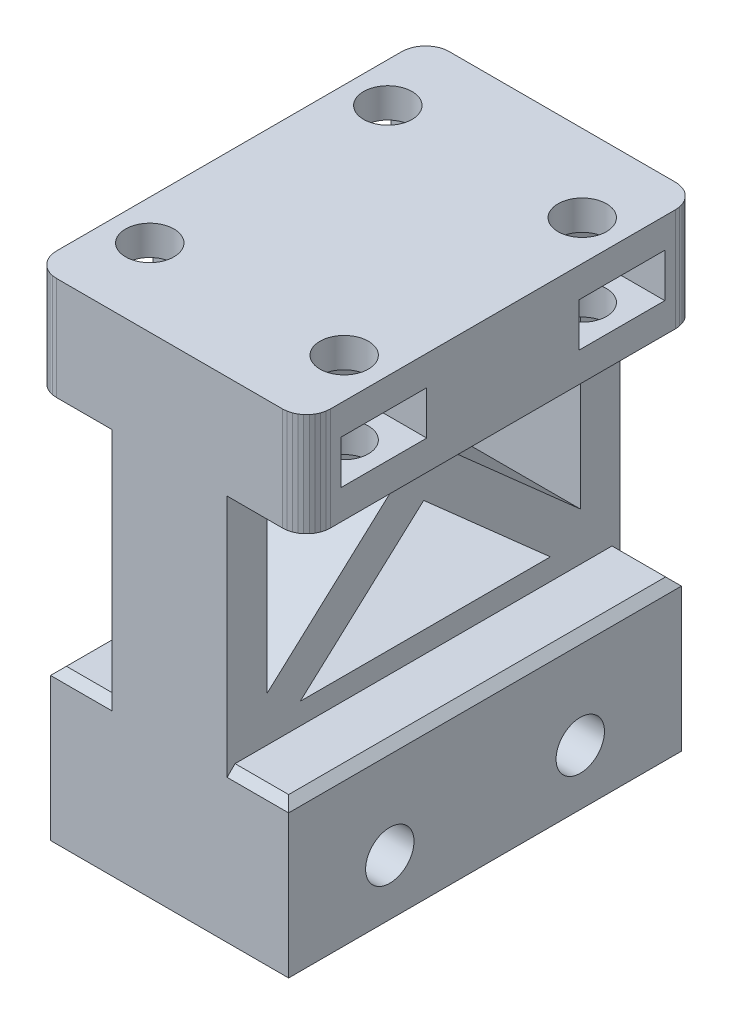
from build123d import *

# Parameters (mm, degrees)
BOSS_EXTRUDE1_DEPTH = 14.49996233
SKETCH2_W           = 14.49996233
SKETCH2_H           = 39.499998092
BOSS_EXTRUDE2_DEPTH = 25.642454624
SKETCH3_W           = 14.49996233
SKETCH3_H           = 49.71832037
BOSS_EXTRUDE3_DEPTH = 4.999995232
SKETCH4_W           = 14.49996233
SKETCH4_H           = 49.71832037
BOSS_EXTRUDE4_DEPTH = 4.999995232
BOSS_EXTRUDE5_DEPTH = 13.000011444
SKETCH6_W           = 49.499988556
SKETCH6_H           = 20.018339158
BOSS_EXTRUDE6_DEPTH = 7.750034332
SKETCH7_W           = 49.499988556
SKETCH7_H           = 20.018339158
BOSS_EXTRUDE7_DEPTH = 7.750034332
CUT_EXTRUDE1_DEPTH  = 5.499958992
CUT_EXTRUDE2_START  = -13.000012
SKETCH9_R           = 3.049969673
CUT_EXTRUDE2_DEPTH  = 13.000012
CUT_EXTRUDE3_DEPTH  = 5.499958992
CUT_EXTRUDE4_REACH  = 1463.704
SKETCH11_R          = 3.049969673
CUT_EXTRUDE5_DEPTH  = 5.499958992
CUT_EXTRUDE6_REACH  = 1463.704
SKETCH13_R          = 3.049969673
CUT_EXTRUDE7_DEPTH  = 5.499958992
CUT_EXTRUDE8_REACH  = 1463.704
SKETCH15_R          = 3.049969673
SKETCH16_R          = 3.049999475
CUT_EXTRUDE9_DEPTH  = 1577.146186494
SKETCH17_R          = 3.049999475
CUT_EXTRUDE10_DEPTH = 1577.146187713
CUT_EXTRUDE15_DEPTH = 1577.006659293
CHAMFER1_SIZE2      = 0.999987125
CHAMFER1_SIZE       = 1.00004673
CHAMFER2_SIZE       = 1.00004673


with BuildPart() as part:
    # Sketch1 → Boss-Extrude1 (new body)
    with BuildSketch(Plane(origin=(652.042150497, 0, 0), x_dir=(0, -1, 0), z_dir=(-1, 0, 0))):
        Polygon((-861.958086491, 1249.692678452), (-861.958086491, 1289.192676544), (-876.510083675, 1273.185491562), (-886.033952236, 1283.933758736), (-886.033952236, 1255.276203156), (-876.557826996, 1265.699982643), (-862.374186516, 1249.692678452), align=None)
    extrude(amount=-BOSS_EXTRUDE1_DEPTH)

    # Sketch2 → Boss-Extrude2 (add)
    with BuildSketch(Plane.XZ.offset(-861.958086491)):
        with Locations((659.292131662, 1269.442677498)):
            Rectangle(SKETCH2_W, SKETCH2_H)
    extrude(amount=BOSS_EXTRUDE2_DEPTH)

    # Sketch3 → Boss-Extrude3 (add)
    with BuildSketch(Plane(origin=(0, 0, 1249.692678452), x_dir=(-1, 0, 0), z_dir=(0, 0, -1))):
        with Locations((-659.292131662, 861.174792051)):
            Rectangle(SKETCH3_W, SKETCH3_H)
    extrude(amount=BOSS_EXTRUDE3_DEPTH)

    # Sketch4 → Boss-Extrude4 (add)
    with BuildSketch(Plane.XY.offset(1289.192676544)):
        with Locations((659.292131662, 861.174792051)):
            Rectangle(SKETCH4_W, SKETCH4_H)
    extrude(amount=BOSS_EXTRUDE4_DEPTH)

    # Sketch5 → Boss-Extrude5 (add)
    with BuildSketch(Plane(origin=(0, 886.033952236, 0), x_dir=(-1, 0, 0), z_dir=(0, 1, 0))):
        Polygon((-642.744004726, 1245.764374733), (-643.113732338, 1245.394587517), (-643.54211092, 1245.094656944), (-644.016087055, 1244.873642921), (-644.521176815, 1244.738340378), (-645.04212141, 1244.69268322), (-673.542141914, 1244.69268322), (-674.06308651, 1244.738340378), (-674.56817627, 1244.873642921), (-675.042152405, 1245.094656944), (-675.470471382, 1245.394587517), (-675.840258598, 1245.764374733), (-676.140189171, 1246.19269371), (-676.361203194, 1246.666669846), (-676.496565342, 1247.171759605), (-676.542103291, 1247.692704201), (-676.542103291, 1291.192650795), (-676.496565342, 1291.71359539), (-676.361203194, 1292.21868515), (-676.140189171, 1292.692661285), (-675.840258598, 1293.121099472), (-675.470471382, 1293.490767479), (-675.042152405, 1293.790817261), (-674.56817627, 1294.011712074), (-674.06308651, 1294.147133827), (-673.542141914, 1294.192671776), (-645.04212141, 1294.192671776), (-644.521176815, 1294.147133827), (-644.016087055, 1294.011712074), (-643.54211092, 1293.790817261), (-643.113732338, 1293.490767479), (-642.744004726, 1293.121099472), (-642.444074154, 1292.692661285), (-642.223060131, 1292.21868515), (-642.087697983, 1291.71359539), (-642.04210043, 1291.192650795), (-642.04210043, 1247.692704201), (-642.087697983, 1247.171759605), (-642.223060131, 1246.666669846), (-642.444074154, 1246.19269371), align=None)
    extrude(amount=BOSS_EXTRUDE5_DEPTH)

    # Sketch6 → Boss-Extrude6 (add)
    with BuildSketch(Plane.ZY.offset(-652.042150497)):
        with Locations((1269.442677498, 846.324801445)):
            Rectangle(SKETCH6_W, SKETCH6_H)
    extrude(amount=BOSS_EXTRUDE6_DEPTH)

    # Sketch7 → Boss-Extrude7 (add)
    with BuildSketch(Plane(origin=(666.542112827, 0, 0), x_dir=(0, 0, -1), z_dir=(1, 0, 0))):
        with Locations((-1269.442677498, 846.324801445)):
            Rectangle(SKETCH7_W, SKETCH7_H)
    extrude(amount=BOSS_EXTRUDE7_DEPTH)

    # Sketch8 → Cut-Extrude1 (cut)
    with BuildSketch(Plane.XZ.offset(-889.783978462)):
        Polygon((676.542103291, 1259.846687317), (668.422102928, 1259.846687317), (665.302097797, 1254.442691803), (668.422102928, 1249.038696289), (676.542103291, 1249.038696289), align=None)
    extrude(amount=-CUT_EXTRUDE1_DEPTH, mode=Mode.SUBTRACT)

    # Sketch9 → Cut-Extrude2 (cut)
    with BuildSketch(Plane(origin=(0, 899.03396368, 0), x_dir=(-1, 0, 0), z_dir=(0, 1, 0)).offset(CUT_EXTRUDE2_START)):
        with Locations(Location((-671.542108059, 1254.442691803, 0), (0, 0, 90))):
            Circle(SKETCH9_R)
    extrude(amount=CUT_EXTRUDE2_DEPTH, mode=Mode.SUBTRACT)

    # Sketch10 → Cut-Extrude3 (cut)
    with BuildSketch(Plane.XZ.offset(-889.783978462)):
        Polygon((642.04210043, 1249.038696289), (650.162100792, 1249.038696289), (653.282105923, 1254.442691803), (650.162100792, 1259.846687317), (642.04210043, 1259.846687317), align=None)
    extrude(amount=-CUT_EXTRUDE3_DEPTH, mode=Mode.SUBTRACT)

    # Cut-Extrude4: up to this face of the body (flat: up to its plane)
    cut_extrude4_end = Plane(part.part.faces().sort_by_distance((643.088277536, 886.033952236, 1246.324624689))[0])
    # Sketch11 → Cut-Extrude4 (cut, up to the picked face)
    with BuildSketch(Plane(origin=(0, 899.03396368, 0), x_dir=(-1, 0, 0), z_dir=(0, 1, 0)), mode=Mode.PRIVATE) as cut_extrude4_sk1:
        with Locations(Location((-647.042095661, 1254.442691803, 0), (0, 0, 90))):
            Circle(SKETCH11_R)
    cut_extrude4_tool1 = split(extrude(cut_extrude4_sk1.sketch, amount=-CUT_EXTRUDE4_REACH, mode=Mode.PRIVATE), bisect_by=cut_extrude4_end, keep=Keep.BOTH, mode=Mode.PRIVATE)
    add(cut_extrude4_tool1.solids().sort_by(Axis((647.042096, 899.033964, 1254.442692), (0, -1, 0)))[0], mode=Mode.SUBTRACT)

    # Sketch12 → Cut-Extrude5 (cut)
    with BuildSketch(Plane.XZ.offset(-889.783978462)):
        Polygon((642.04210043, 1279.038667679), (650.162100792, 1279.038667679), (653.282105923, 1284.442663193), (650.162100792, 1289.846658707), (642.04210043, 1289.846658707), align=None)
    extrude(amount=-CUT_EXTRUDE5_DEPTH, mode=Mode.SUBTRACT)

    # Cut-Extrude6: up to this face of the body (flat: up to its plane)
    cut_extrude6_end = Plane(part.part.faces().sort_by_distance((643.088277536, 886.033952236, 1246.324624689))[0])
    # Sketch13 → Cut-Extrude6 (cut, up to the picked face)
    with BuildSketch(Plane(origin=(0, 899.03396368, 0), x_dir=(-1, 0, 0), z_dir=(0, 1, 0)), mode=Mode.PRIVATE) as cut_extrude6_sk1:
        with Locations(Location((-647.042095661, 1284.442663193, 0), (0, 0, 90))):
            Circle(SKETCH13_R)
    cut_extrude6_tool1 = split(extrude(cut_extrude6_sk1.sketch, amount=-CUT_EXTRUDE6_REACH, mode=Mode.PRIVATE), bisect_by=cut_extrude6_end, keep=Keep.BOTH, mode=Mode.PRIVATE)
    add(cut_extrude6_tool1.solids().sort_by(Axis((647.042096, 899.033964, 1284.442663), (0, -1, 0)))[0], mode=Mode.SUBTRACT)

    # Sketch14 → Cut-Extrude7 (cut)
    with BuildSketch(Plane.XZ.offset(-889.783978462)):
        Polygon((676.542103291, 1289.846658707), (668.422102928, 1289.846658707), (665.302097797, 1284.442663193), (668.422102928, 1279.038667679), (676.542103291, 1279.038667679), align=None)
    extrude(amount=-CUT_EXTRUDE7_DEPTH, mode=Mode.SUBTRACT)

    # Cut-Extrude8: up to this face of the body (flat: up to its plane)
    cut_extrude8_end = Plane(part.part.faces().sort_by_distance((643.088277536, 886.033952236, 1246.324624689))[0])
    # Sketch15 → Cut-Extrude8 (cut, up to the picked face)
    with BuildSketch(Plane(origin=(0, 899.03396368, 0), x_dir=(-1, 0, 0), z_dir=(0, 1, 0)), mode=Mode.PRIVATE) as cut_extrude8_sk1:
        with Locations(Location((-671.542108059, 1284.442663193, 0), (0, 0, 90))):
            Circle(SKETCH15_R)
    cut_extrude8_tool1 = split(extrude(cut_extrude8_sk1.sketch, amount=-CUT_EXTRUDE8_REACH, mode=Mode.PRIVATE), bisect_by=cut_extrude8_end, keep=Keep.BOTH, mode=Mode.PRIVATE)
    add(cut_extrude8_tool1.solids().sort_by(Axis((671.542108, 899.033964, 1284.442663), (0, -1, 0)))[0], mode=Mode.SUBTRACT)

    # Sketch16 → Cut-Extrude9 (cut, through all)
    with BuildSketch(Plane.ZY.offset(-644.292116165)):
        with Locations((1281.442642212, 844.333976507)):
            Circle(SKETCH16_R)
    extrude(amount=-CUT_EXTRUDE9_DEPTH, mode=Mode.SUBTRACT)

    # Sketch17 → Cut-Extrude10 (cut, through all)
    with BuildSketch(Plane(origin=(674.29214716, 0, 0), x_dir=(0, 0, -1), z_dir=(1, 0, 0))):
        with Locations((-1257.442712784, 844.333976507)):
            Circle(SKETCH17_R)
    extrude(amount=-CUT_EXTRUDE10_DEPTH, mode=Mode.SUBTRACT)

    # Sketch22 → Cut-Extrude15 (cut, through all)
    with BuildSketch(Plane(origin=(666.542112827, 0, 0), x_dir=(0, 0, -1), z_dir=(1, 0, 0))):
        Polygon((-1253.462314606, 859.033942223), (-1269.421219826, 873.174786568), (-1284.976124763, 859.033942223), align=None)
    extrude(amount=-CUT_EXTRUDE15_DEPTH, mode=Mode.SUBTRACT)

    # Chamfer1
    chamfer1_edges = [part.edges().sort_by_distance(p)[0] for p in [
        (648.167133331, 856.333971024, 1294.192671776),
        (648.167133331, 856.333971024, 1244.69268322),
        (644.292116165, 856.333971024, 1269.442677498),
        (670.417129993, 856.333971024, 1244.69268322),
        (670.417129993, 856.333971024, 1294.192671776),
        (674.29214716, 856.333971024, 1269.442677498),
    ]]
    chamfer(chamfer1_edges, length=CHAMFER1_SIZE, length2=CHAMFER1_SIZE2)

    # Chamfer2
    chamfer2_edges = [part.edges().sort_by_distance(p)[0] for p in [
        (644.292116165, 836.315631866, 1269.442677498),
        (674.29214716, 836.315631866, 1269.442677498),
        (659.292131662, 836.315631866, 1244.69268322),
        (659.292131662, 836.315631866, 1294.192671776),
    ]]
    chamfer(chamfer2_edges, length=CHAMFER2_SIZE)


solid = part.part
